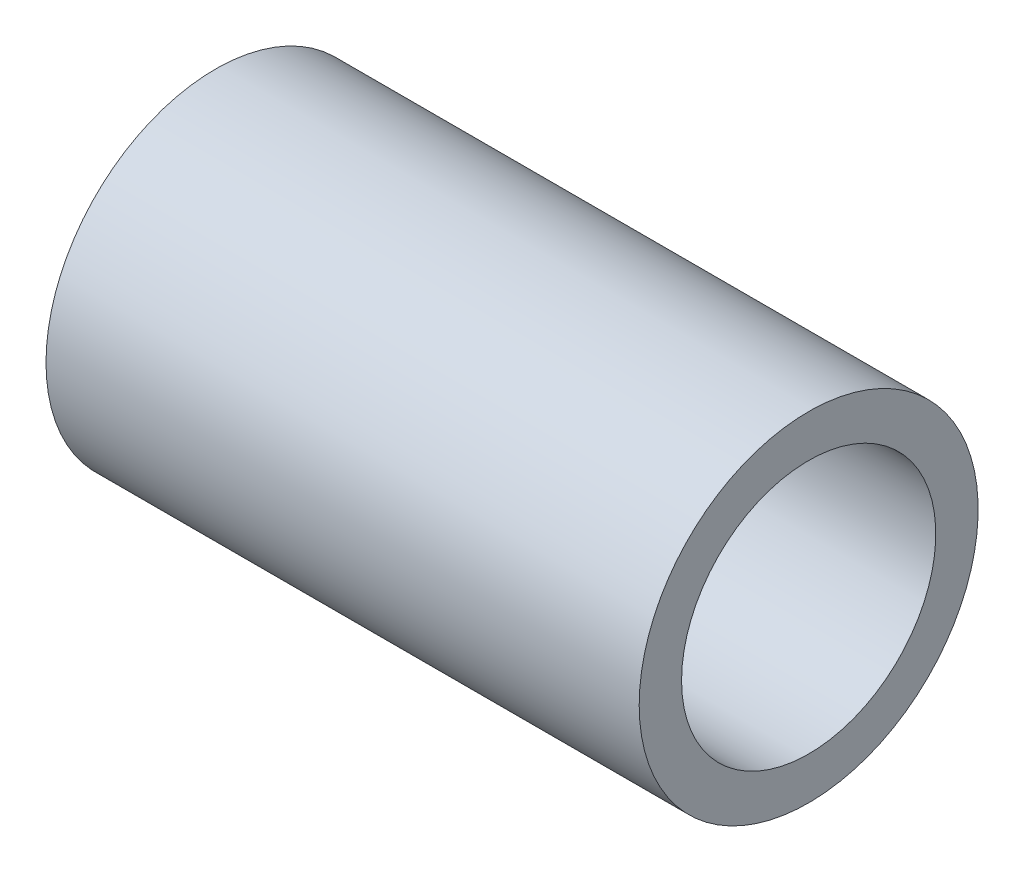
from build123d import *

# Parameters (mm, degrees)
SKETCH1_W = 7
SKETCH1_H = 0.5


with BuildPart() as part:
    # Sketch1 → Revolve1 (revolve)
    with BuildSketch(Plane.XY, mode=Mode.PRIVATE) as revolve1_sk:
        with Locations((0, 1.75)):
            Rectangle(SKETCH1_W, SKETCH1_H)
    revolve(revolve1_sk.sketch.rotate(Axis((-0.962623157, 0, 0), (1, 0, 0)), 90), axis=Axis((-0.962623157, 0, 0), (1, 0, 0)))


solid = part.part
